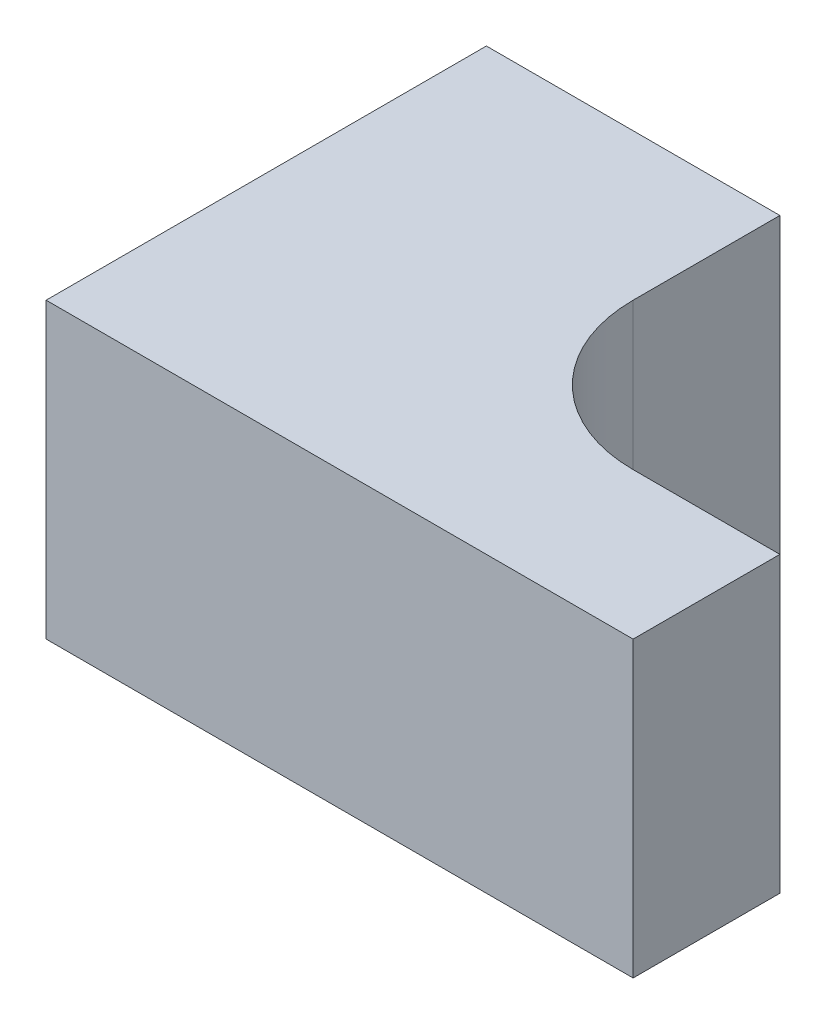
from build123d import *

# Parameters (mm, degrees)
BOSS_EXTRUDE1_DEPTH = 20


with BuildPart() as part:
    # Sketch2 → Boss-Extrude1 (new body)
    with BuildSketch(Plane(origin=(0, 0, 0), x_dir=(1, 0, 0), z_dir=(0, 1, 0))):
        with BuildLine():
            Line((0, 0), (0, -10))
            ThreePointArc((0, -10), (2.928932188, -17.071067812), (10, -20))
            Line((10, -20), (20, -20))
            Line((20, -20), (20, -30))
            Line((20, -30), (-20, -30))
            Line((-20, -30), (-20, 0))
            Line((-20, 0), (0, 0))
        make_face()
    extrude(amount=BOSS_EXTRUDE1_DEPTH)


solid = part.part
